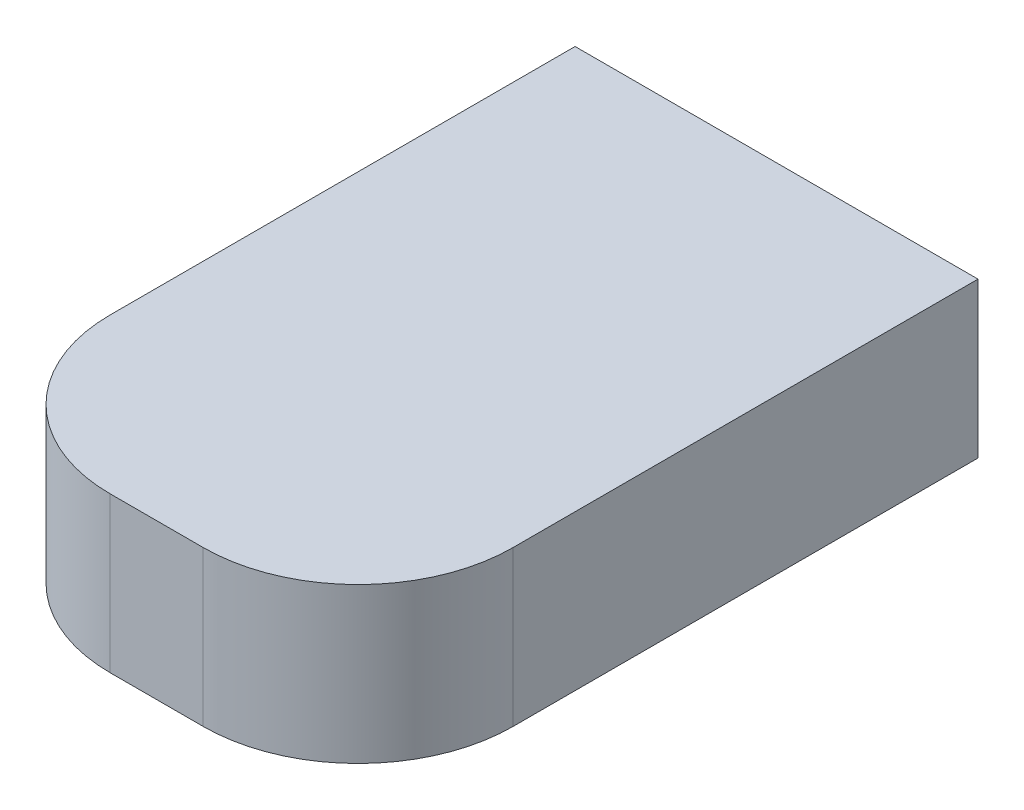
from build123d import *

# Parameters (mm, degrees)
SKETCH1_W           = 3.9
SKETCH1_H           = 6
BOSS_EXTRUDE1_DEPTH = 1.5
FILLET1_R           = 1.5


with BuildPart() as part:
    # Sketch1 → Boss-Extrude1 (new body)
    with BuildSketch(Plane(origin=(0, 0, 0), x_dir=(1, 0, 0), z_dir=(0, 1, 0))):
        Rectangle(SKETCH1_W, SKETCH1_H)
    extrude(amount=BOSS_EXTRUDE1_DEPTH)

    # Fillet1
    fillet1_edges = [part.edges().sort_by_distance(p)[0] for p in [
        (1.95, 0.75, 3),
        (-1.95, 0.75, 3),
    ]]
    fillet(fillet1_edges, radius=FILLET1_R)


solid = part.part
